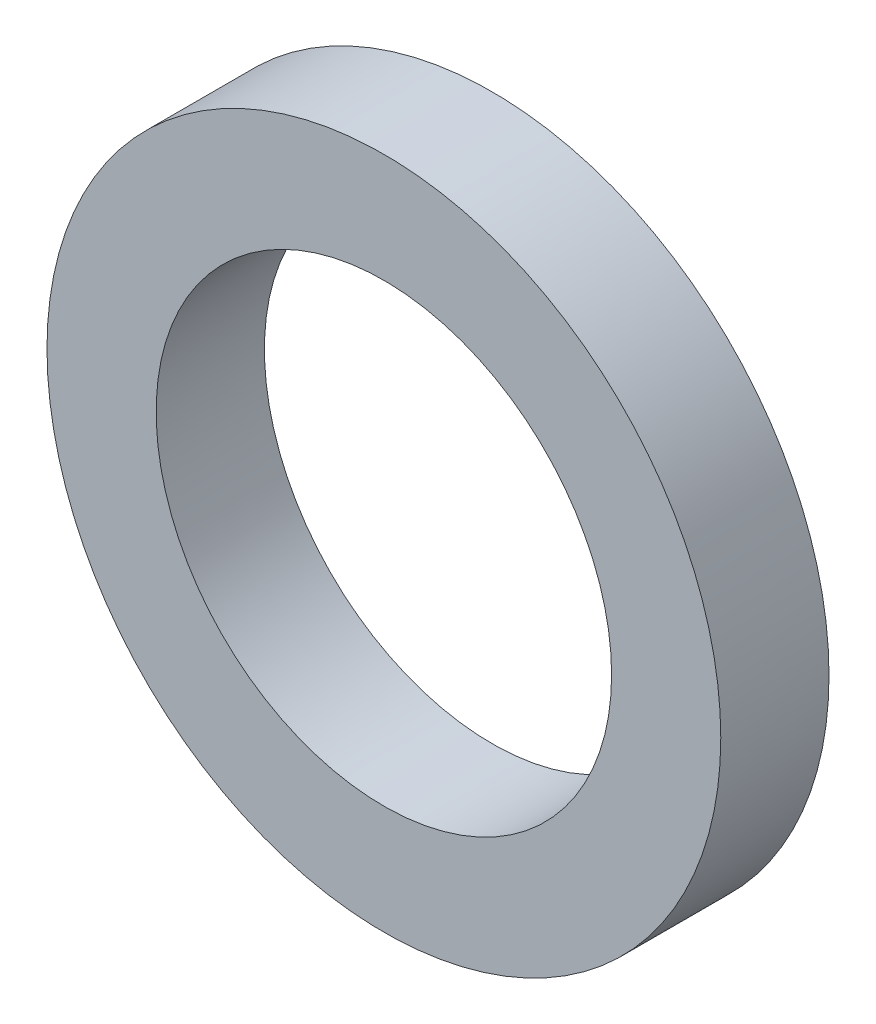
from build123d import *

# Parameters (mm, degrees)
SKETCH1_R           = 39.22
SKETCH1_R_2         = 26.51
BOSS_EXTRUDE1_DEPTH = 12.6


with BuildPart() as part:
    # Sketch1 → Boss-Extrude1 (new body)
    with BuildSketch(Plane.XY):
        Circle(SKETCH1_R)
        Circle(SKETCH1_R_2, mode=Mode.SUBTRACT)
    extrude(amount=BOSS_EXTRUDE1_DEPTH)


solid = part.part
